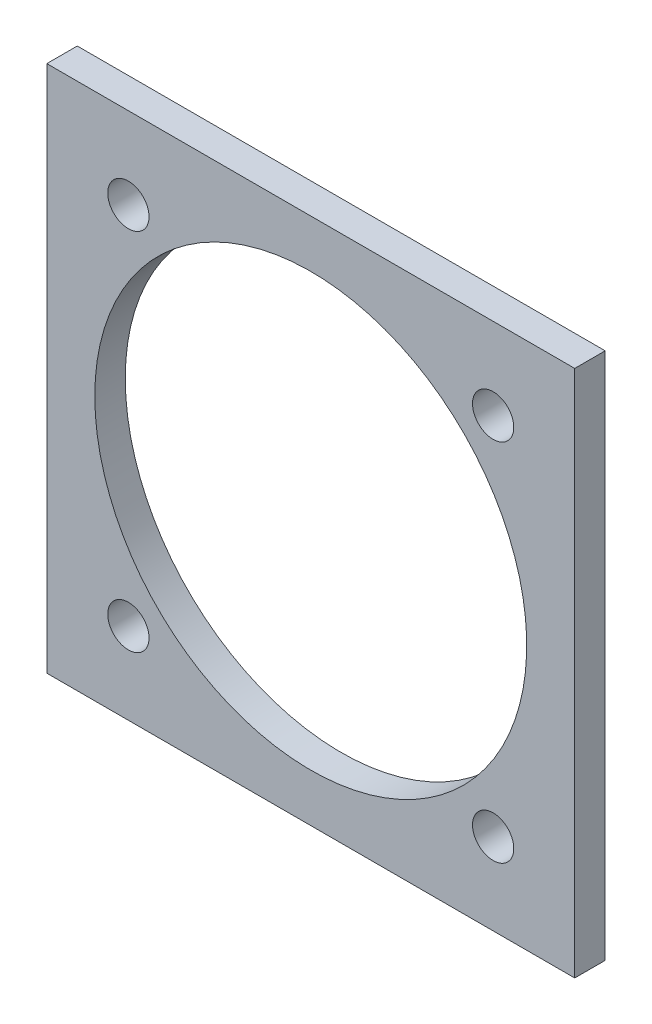
from build123d import *

# Parameters (mm, degrees)
SKETCH1_W           = 55
SKETCH1_H           = 55
SKETCH1_R           = 22.5
SKETCH1_R_2         = 2.15
BOSS_EXTRUDE1_DEPTH = 3.175


with BuildPart() as part:
    # Sketch1 → Boss-Extrude1 (new body)
    with BuildSketch(Plane.XY):
        Rectangle(SKETCH1_W, SKETCH1_H)
        Circle(SKETCH1_R, mode=Mode.SUBTRACT)
        with Locations((19, 19)):
            Circle(SKETCH1_R_2, mode=Mode.SUBTRACT)
        with Locations((19, -19)):
            Circle(SKETCH1_R_2, mode=Mode.SUBTRACT)
        with Locations((-19, -19)):
            Circle(SKETCH1_R_2, mode=Mode.SUBTRACT)
        with Locations((-19, 19)):
            Circle(SKETCH1_R_2, mode=Mode.SUBTRACT)
    extrude(amount=BOSS_EXTRUDE1_DEPTH)


solid = part.part
